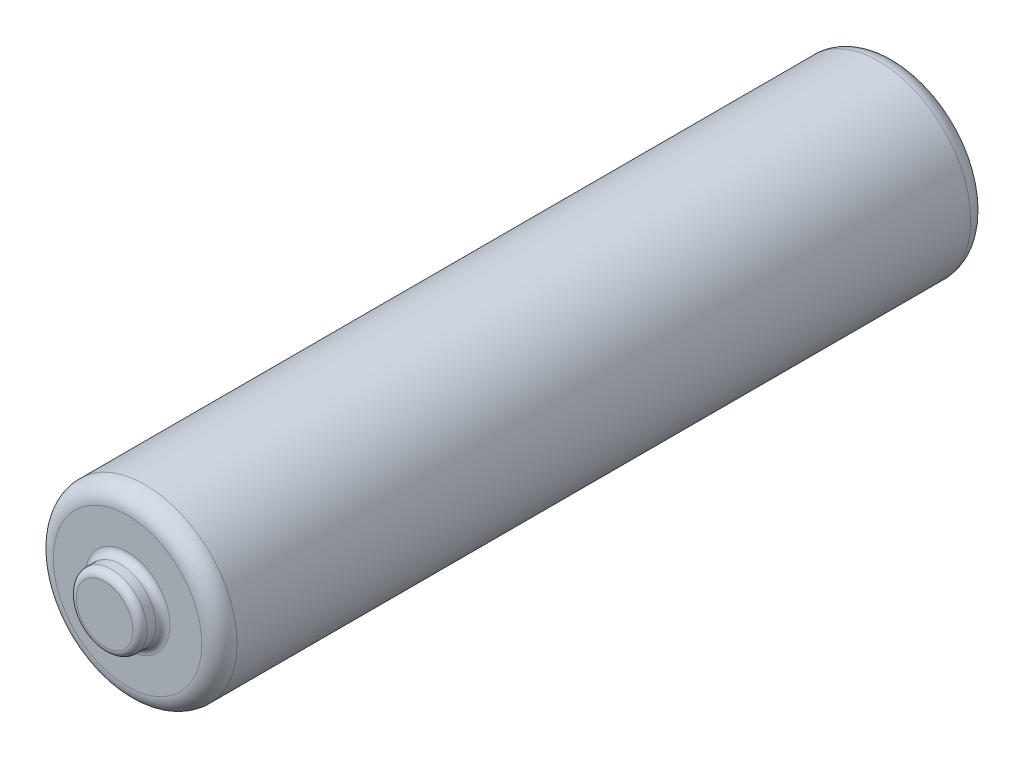
from build123d import *

# Parameters (mm, degrees)
SKETCH1_R           = 5.2
BOSS_EXTRUDE1_DEPTH = 43.5
SKETCH2_R           = 2
BOSS_EXTRUDE2_DEPTH = 1.3
FILLET1_R           = 1
FILLET2_R           = 0.4


with BuildPart() as part:
    # Sketch1 → Boss-Extrude1 (new body)
    with BuildSketch(Plane.XY):
        Circle(SKETCH1_R)
    extrude(amount=BOSS_EXTRUDE1_DEPTH)

    # Sketch2 → Boss-Extrude2 (add)
    with BuildSketch(Plane.XY.offset(43.5)):
        Circle(SKETCH2_R)
    extrude(amount=BOSS_EXTRUDE2_DEPTH)

    # Fillet1
    fillet1_edges = [part.edges().sort_by_distance(p)[0] for p in [
        (-5.2, 0, 0),
        (-5.2, 0, 43.5),
    ]]
    fillet(fillet1_edges, radius=FILLET1_R)

    # Fillet2
    fillet2_edges = [part.edges().sort_by_distance(p)[0] for p in [
        (-2, 0, 43.5),
        (-2, 0, 44.8),
    ]]
    fillet(fillet2_edges, radius=FILLET2_R)


solid = part.part
